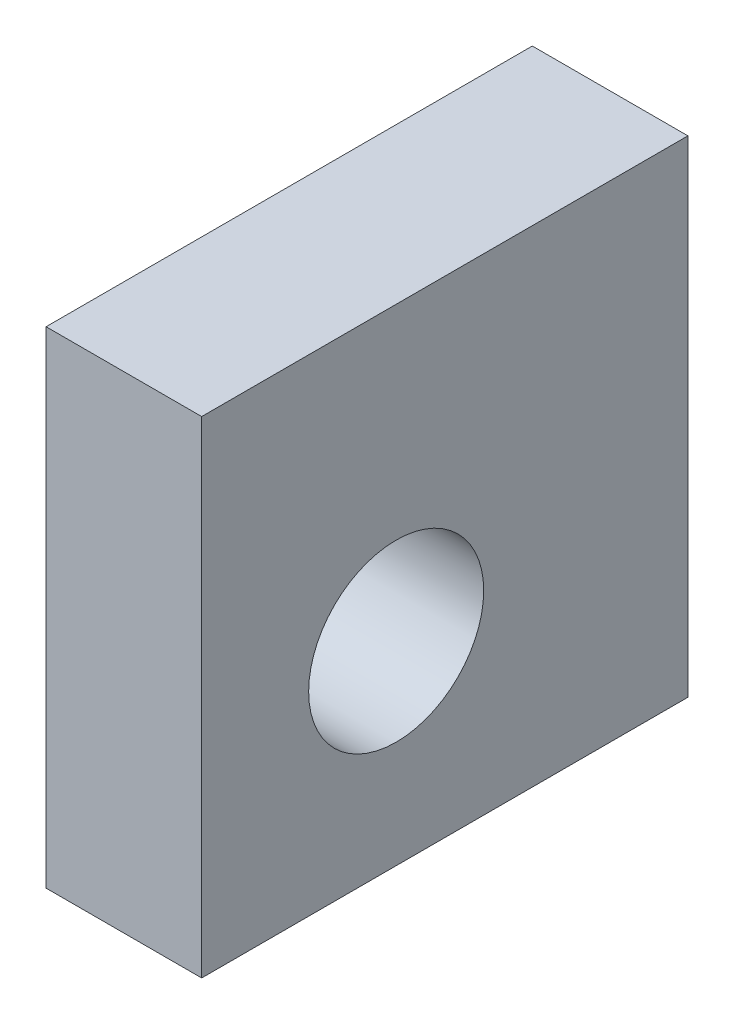
from build123d import *

# Parameters (mm, degrees)
SKETCH1_W           = 25
SKETCH1_H           = 25
SKETCH1_R           = 4.5
BOSS_EXTRUDE1_DEPTH = 8


with BuildPart() as part:
    # Sketch1 → Boss-Extrude1 (new body)
    with BuildSketch(Plane(origin=(0, 0, 0), x_dir=(0, 0, -1), z_dir=(1, 0, 0))):
        Rectangle(SKETCH1_W, SKETCH1_H)
        with Locations((-2.5, -2.5)):
            Circle(SKETCH1_R, mode=Mode.SUBTRACT)
    extrude(amount=BOSS_EXTRUDE1_DEPTH)


solid = part.part
